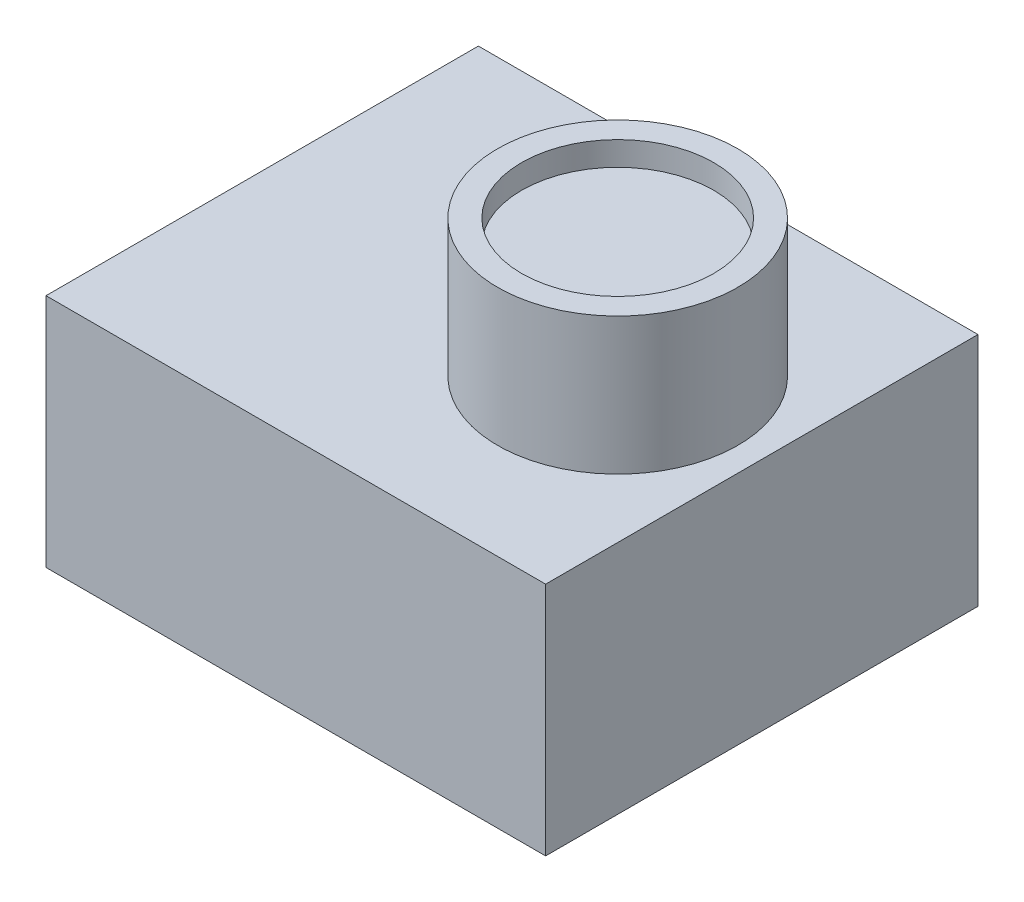
from build123d import *

# Parameters (mm, degrees)
SKETCH1_W           = 208
SKETCH1_H           = 180
BOSS_EXTRUDE1_DEPTH = 98
SKETCH2_R           = 50
BOSS_EXTRUDE2_DEPTH = 57
SKETCH3_R           = 40
CUT_EXTRUDE1_DEPTH  = 10


with BuildPart() as part:
    # Sketch1 → Boss-Extrude1 (new body)
    with BuildSketch(Plane(origin=(0, 0, 0), x_dir=(1, 0, 0), z_dir=(0, 1, 0))):
        Rectangle(SKETCH1_W, SKETCH1_H)
    extrude(amount=BOSS_EXTRUDE1_DEPTH)

    # Sketch2 → Boss-Extrude2 (add)
    with BuildSketch(Plane(origin=(0, 98, 0), x_dir=(1, 0, 0), z_dir=(0, 1, 0))):
        with Locations(Location((44, 0, 0), (0, 0, 90))):
            Circle(SKETCH2_R)
    extrude(amount=BOSS_EXTRUDE2_DEPTH)

    # Sketch3 → Cut-Extrude1 (cut)
    with BuildSketch(Plane(origin=(0, 155, 0), x_dir=(1, 0, 0), z_dir=(0, 1, 0))):
        with Locations(Location((44, 0, 0), (0, 0, 270))):
            Circle(SKETCH3_R)
    extrude(amount=-CUT_EXTRUDE1_DEPTH, mode=Mode.SUBTRACT)


solid = part.part
